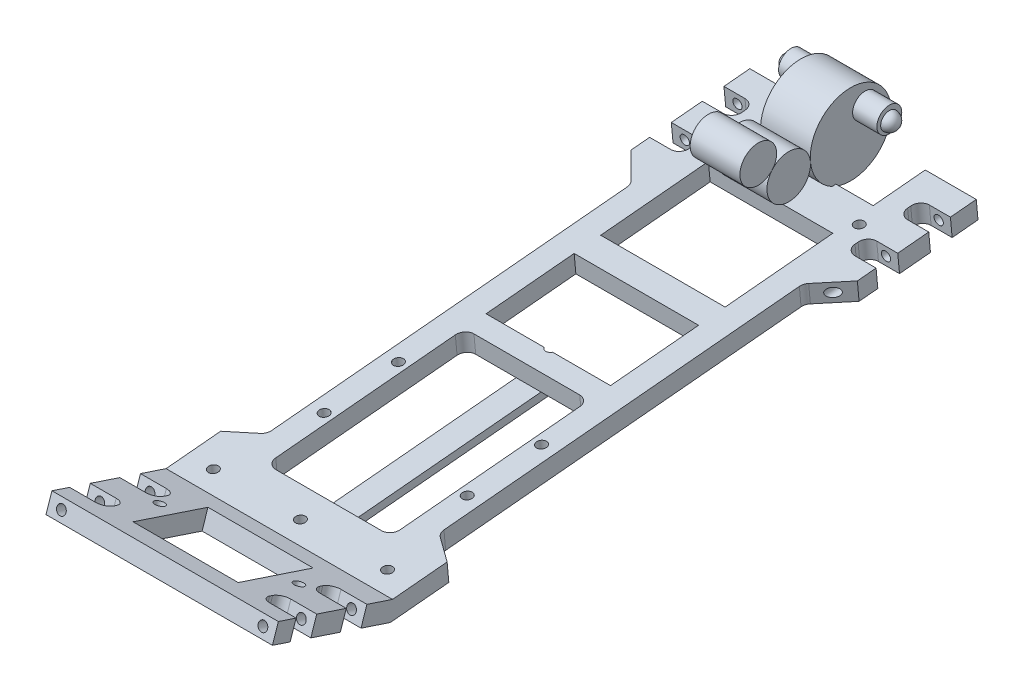
from build123d import *

# Parameters (mm, degrees)
FRAME_DEPTH              = 46.228
SKETCH7_R                = 2.032
SKETCH7_W                = 50.8
SKETCH7_H                = 73.673589013
SKETCH7_H_2              = 44.16344942
SKETCH7_H_3              = 36.113405855
BATTERY_SLOT_DEPTH       = 32.131
EXTRUDE25_DEPTH          = 12.7
LOW_A_ARM_MOUNTING_DEPTH = 18.288
SKETCH25_R               = 1.905
REAR_HINGE_HOLES_DEPTH   = 72.39
SKETCH26_R               = 16.51
EXTRUDE18_DEPTH          = 10.16
EXTRUDE18_2_DEPTH        = 10.16
SKETCH26_R_2             = 7.493
EXTRUDE18_3_DEPTH        = 10.16
SKETCH27_R               = 5.08
EXTRUDE19_DEPTH          = 20.066
SKETCH33_R               = 2.032
SKETCH33_R_2             = 1.905
EXTRUDE23_DEPTH          = 47.244
SKETCH32_R               = 2.032
SKETCH32_W               = 42.951687192
SKETCH32_H               = 32.245461994
EXTRUDE24_DEPTH          = 48.26
SKETCH34_R               = 1.905
EXTRUDE26_DEPTH          = 45.72
SKETCH38_R               = 2.032
EXTRUDE29_DEPTH          = 10
SKETCH35_R               = 2.032
EXTRUDE30_DEPTH          = 3.175


with BuildPart() as part:
    # Sketch2 → Frame (new, symmetric)
    with BuildSketch(Plane(origin=(0, 0, 0), x_dir=(0, 0, -1), z_dir=(1, 0, 0))):
        Polygon((-113.496221263, -18.267135855), (-65.375232853, -34.246135229), (199.160392748, -9.556529022), (198.452281288, -1.969502058), (-64.49133225, -26.510522792), (-111.094862411, -11.035408837), align=None)
    extrude(amount=FRAME_DEPTH, both=True)

    # Sketch7 → Battery Slot (cut)
    with BuildSketch(Plane(origin=(0, -20.314469691, -1.895987566), x_dir=(1, 0, 0), z_dir=(0, 0.9956728299897474, 0.0929280131080388))):
        with Locations((29.216865034, 11.53061946)):
            Circle(SKETCH7_R)
        with Locations((-29.216865034, 11.53061946)):
            Circle(SKETCH7_R)
        with Locations((-29.216865034, -18.94938054)):
            Circle(SKETCH7_R)
        with Locations((29.216865034, -18.94938054)):
            Circle(SKETCH7_R)
        with BuildLine():
            Line((-21.59, 34.834750886), (21.59, 34.834750886))
            ThreePointArc((21.59, 34.834750886), (24.284076836, 33.718827722), (25.4, 31.024750886))
            Line((25.4, 31.024750886), (25.4, -42.602437917))
            ThreePointArc((25.4, -42.602437917), (24.284076836, -45.296514753), (21.59, -46.412437917))
            Line((21.59, -46.412437917), (-21.59, -46.412437917))
            ThreePointArc((-21.59, -46.412437917), (-24.284076836, -45.296514753), (-25.4, -42.602437917))
            Line((-25.4, -42.602437917), (-25.4, 31.024750886))
            ThreePointArc((-25.4, 31.024750886), (-24.284076836, 33.718827722), (-21.59, 34.834750886))
        make_face()
        with Locations((0, 188.156895099)):
            Rectangle(SKETCH7_W, SKETCH7_H)
        with BuildLine():
            Line((55.96082371, -51.188879708), (36.758181354, -37.566371958))
            ThreePointArc((36.758181354, -37.566371958), (35.577748237, -36.207761713), (35.152650581, -34.458894617))
            Line((35.152650581, -34.458894617), (35.152650581, 111.272094787))
            ThreePointArc((35.152650581, 111.272094787), (35.442669563, 112.730118664), (36.268573745, 113.966171623))
            Line((36.268573745, 113.966171623), (55.96082371, 133.658421588))
            Line((55.96082371, 133.658421588), (55.96082371, -51.188879708))
        make_face()
        with BuildLine():
            Line((-55.96082371, 133.658421588), (-55.96082371, -51.188879708))
            Line((-55.96082371, -51.188879708), (-36.758181354, -37.566371958))
            ThreePointArc((-36.758181354, -37.566371958), (-35.577748237, -36.207761713), (-35.152650581, -34.458894617))
            Line((-35.152650581, -34.458894617), (-35.152650581, 111.272094787))
            ThreePointArc((-35.152650581, 111.272094787), (-35.442669563, 112.730118664), (-36.268573745, 113.966171623))
            Line((-36.268573745, 113.966171623), (-55.96082371, 133.658421588))
        make_face()
        with Locations((0, 112.716639569)):
            Rectangle(SKETCH7_W, SKETCH7_H_2)
        with Locations((0, 61.686944831)):
            Rectangle(SKETCH7_W, SKETCH7_H_3)
    extrude(amount=-BATTERY_SLOT_DEPTH, mode=Mode.SUBTRACT)

    # Sketch20 → Extrude25 (cut)
    with BuildSketch(Plane(origin=(0, -50.397568307, 16.734957844), x_dir=(1, 0, 0), z_dir=(0, -0.9490455404212153, 0.31513895698025596))):
        with BuildLine():
            Line((54.692263435, 94.336396504), (35.646708176, 94.336396504))
            ThreePointArc((35.646708176, 94.336396504), (32.952631339, 93.22047334), (31.836708176, 90.526396504))
            Line((31.836708176, 90.526396504), (31.836708176, 89.256396504))
            ThreePointArc((31.836708176, 89.256396504), (32.952631339, 86.562319667), (35.646708176, 85.446396504))
            Line((35.646708176, 85.446396504), (51.961047829, 85.446396504))
            Line((51.961047829, 85.446396504), (51.961047829, 72.746396504))
            Line((51.961047829, 72.746396504), (35.646708176, 72.746396504))
            ThreePointArc((35.646708176, 72.746396504), (32.952631339, 71.63047334), (31.836708176, 68.936396504))
            Line((31.836708176, 68.936396504), (31.836708176, 67.666396504))
            ThreePointArc((31.836708176, 67.666396504), (32.952631339, 64.972319667), (35.646708176, 63.856396504))
            Line((35.646708176, 63.856396504), (54.692263435, 63.856396504))
            Line((54.692263435, 63.856396504), (54.692263435, 94.336396504))
        make_face()
        with BuildLine():
            Line((-31.836708176, 68.936396504), (-31.836708176, 67.666396504))
            ThreePointArc((-31.836708176, 67.666396504), (-32.952631339, 64.972319667), (-35.646708176, 63.856396504))
            Line((-35.646708176, 63.856396504), (-54.692263435, 63.856396504))
            Line((-54.692263435, 63.856396504), (-54.692263435, 94.336396504))
            Line((-54.692263435, 94.336396504), (-35.646708176, 94.336396504))
            ThreePointArc((-35.646708176, 94.336396504), (-32.952631339, 93.22047334), (-31.836708176, 90.526396504))
            Line((-31.836708176, 90.526396504), (-31.836708176, 89.256396504))
            ThreePointArc((-31.836708176, 89.256396504), (-32.952631339, 86.562319667), (-35.646708176, 85.446396504))
            Line((-35.646708176, 85.446396504), (-51.961047829, 85.446396504))
            Line((-51.961047829, 85.446396504), (-51.961047829, 72.746396504))
            Line((-51.961047829, 72.746396504), (-35.646708176, 72.746396504))
            ThreePointArc((-35.646708176, 72.746396504), (-32.952631339, 71.63047334), (-31.836708176, 68.936396504))
        make_face()
    extrude(amount=-EXTRUDE25_DEPTH, mode=Mode.SUBTRACT)

    # Sketch24 → Low A-Arm Mounting (cut)
    with BuildSketch(Plane(origin=(0, -20.314469691, -1.895987566), x_dir=(1, 0, 0), z_dir=(0, 0.9956728299897474, 0.0929280131080388))):
        with BuildLine():
            Line((56.409110401, 131.608548499), (56.409110401, 162.088520321))
            Line((56.409110401, 162.088520321), (37.634475113, 162.088520321))
            ThreePointArc((37.634475113, 162.088520321), (34.940398277, 160.972597157), (33.824475113, 158.278520321))
            Line((33.824475113, 158.278520321), (33.824475113, 157.00853441))
            ThreePointArc((33.824475113, 157.00853441), (34.940398277, 154.314457574), (37.634475113, 153.19853441))
            Line((37.634475113, 153.19853441), (52.193835241, 153.19853441))
            Line((52.193835241, 153.19853441), (52.193835241, 140.49853441))
            Line((52.193835241, 140.49853441), (37.634475113, 140.49853441))
            ThreePointArc((37.634475113, 140.49853441), (34.940398277, 139.382611246), (33.824475113, 136.68853441))
            Line((33.824475113, 136.68853441), (33.824475113, 135.418548499))
            ThreePointArc((33.824475113, 135.418548499), (34.940398277, 132.724471663), (37.634475113, 131.608548499))
            Line((37.634475113, 131.608548499), (56.409110401, 131.608548499))
        make_face()
        with BuildLine():
            Line((-37.634475113, 131.608548499), (-56.409110401, 131.608548499))
            Line((-56.409110401, 131.608548499), (-56.409110401, 162.088520321))
            Line((-56.409110401, 162.088520321), (-37.634475113, 162.088520321))
            ThreePointArc((-37.634475113, 162.088520321), (-34.940398277, 160.972597157), (-33.824475113, 158.278520321))
            Line((-33.824475113, 158.278520321), (-33.824475113, 157.00853441))
            ThreePointArc((-33.824475113, 157.00853441), (-34.940398277, 154.314457574), (-37.634475113, 153.19853441))
            Line((-37.634475113, 153.19853441), (-52.193835241, 153.19853441))
            Line((-52.193835241, 153.19853441), (-52.193835241, 140.49853441))
            Line((-52.193835241, 140.49853441), (-37.634475113, 140.49853441))
            ThreePointArc((-37.634475113, 140.49853441), (-34.940398277, 139.382611246), (-33.824475113, 136.68853441))
            Line((-33.824475113, 136.68853441), (-33.824475113, 135.418548499))
            ThreePointArc((-33.824475113, 135.418548499), (-34.940398277, 132.724471663), (-37.634475113, 131.608548499))
        make_face()
        with BuildLine():
            Line((52.193835241, 172.685517507), (25.496906949, 172.685517507))
            ThreePointArc((25.496906949, 172.685517507), (22.802830113, 173.80144067), (21.686906949, 176.495517507))
            Line((21.686906949, 176.495517507), (21.686906949, 210.279969832))
            Line((21.686906949, 210.279969832), (63.30933631, 210.279969832))
            Line((63.30933631, 210.279969832), (52.193835241, 172.685517507))
        make_face()
        with BuildLine():
            Line((-63.30933631, 210.279969832), (-52.193835241, 172.685517507))
            Line((-52.193835241, 172.685517507), (-25.496906949, 172.685517507))
            ThreePointArc((-25.496906949, 172.685517507), (-22.802830113, 173.80144067), (-21.686906949, 176.495517507))
            Line((-21.686906949, 176.495517507), (-21.686906949, 210.279969832))
            Line((-21.686906949, 210.279969832), (-63.30933631, 210.279969832))
        make_face()
    extrude(amount=-LOW_A_ARM_MOUNTING_DEPTH, mode=Mode.SUBTRACT)

    # Sketch25 → Rear Hinge Holes (cut)
    with BuildSketch(Plane(origin=(0, 16.047322034, -171.938277914), x_dir=(-1, 0, 0), z_dir=(0, 0.09292801310803883, -0.9956728299897473))):
        with Locations((-41.073322363, -24.212755884)):
            Circle(SKETCH25_R)
        with Locations((41.073322363, -24.212755884)):
            Circle(SKETCH25_R)
    extrude(amount=-REAR_HINGE_HOLES_DEPTH, mode=Mode.SUBTRACT)

    # Sketch33 → Extrude23 (cut)
    with BuildSketch(Plane(origin=(0, -27.901496655, -2.604099026), x_dir=(1, 0, 0), z_dir=(0, -0.9956728299897473, -0.09292801310803918))):
        with Locations((28.407237147, -142.60872383)):
            Circle(SKETCH33_R)
        with Locations((-28.407237147, -142.60872383)):
            Circle(SKETCH33_R)
        with Locations((6.985, -101.71320122)):
            Circle(SKETCH33_R_2)
        with Locations((-6.985, -101.71320122)):
            Circle(SKETCH33_R_2)
        with Locations((-6.985, -192.443640667)):
            Circle(SKETCH33_R_2)
        with Locations((6.985, -192.443640667)):
            Circle(SKETCH33_R_2)
    extrude(amount=-EXTRUDE23_DEPTH, mode=Mode.SUBTRACT)

    # Sketch32 → Extrude24 (cut)
    with BuildSketch(Plane(origin=(0, -50.397568307, 16.734957844), x_dir=(1, 0, 0), z_dir=(0, -0.9490455404212153, 0.31513895698025585))):
        with Locations((28.407237147, 74.333896504)):
            Circle(SKETCH32_R)
        with Locations((-28.407237147, 74.333896504)):
            Circle(SKETCH32_R)
        with Locations((0, 77.015866104)):
            Rectangle(SKETCH32_W, SKETCH32_H)
    extrude(amount=-EXTRUDE24_DEPTH, mode=Mode.SUBTRACT)

    # Sketch34 → Extrude26 (cut)
    with BuildSketch(Plane(origin=(0, 32.130432452, 96.761263419), x_dir=(1, 0, 0), z_dir=(0, 0.3151389569802559, 0.9490455404212153))):
        with Locations((-41.141846717, -49.29342461)):
            Circle(SKETCH34_R)
        with Locations((41.141846717, -49.29342461)):
            Circle(SKETCH34_R)
    extrude(amount=-EXTRUDE26_DEPTH, mode=Mode.SUBTRACT)

    # Sketch38 → Extrude29 (cut)
    with BuildSketch(Plane(origin=(0, -20.314469691, -1.895987566), x_dir=(1, 0, 0), z_dir=(0, 0.9956728299897474, 0.0929280131080388))):
        with Locations((0, -57.996941554)):
            Circle(SKETCH38_R)
        with Locations((35.56, -57.996941554)):
            Circle(SKETCH38_R)
        with Locations((-35.56, -57.996941554)):
            Circle(SKETCH38_R)
        with Locations((0, 44.661295459)):
            Circle(SKETCH38_R)
    extrude(amount=-EXTRUDE29_DEPTH, mode=Mode.SUBTRACT)


with BuildPart() as body_2:
    # Sketch26 → Extrude18 (new, symmetric)
    with BuildSketch(Plane(origin=(0, 0, 0), x_dir=(0, 0, -1), z_dir=(1, 0, 0))):
        with Locations((158.63131502, 8.344645738)):
            Circle(SKETCH26_R)
    extrude(amount=EXTRUDE18_DEPTH, both=True)


with BuildPart() as body_3:
    # Sketch26 → Extrude18 2 (new, symmetric)
    with BuildSketch(Plane(origin=(0, 0, 0), x_dir=(0, 0, -1), z_dir=(1, 0, 0))):
        with BuildLine():
            ThreePointArc((142.192481652, 6.813352989), (136.038170827, 14.45971983), (126.595687803, 11.779797825))
            ThreePointArc((126.595687803, 11.779797825), (130.643433481, -2.482098519), (142.192481652, 6.813352989))
        make_face()
    extrude(amount=EXTRUDE18_2_DEPTH, both=True)


with BuildPart() as body_4:
    # Sketch26 → Extrude18 3 (new, symmetric)
    with BuildSketch(Plane(origin=(0, 0, 0), x_dir=(0, 0, -1), z_dir=(1, 0, 0))):
        with Locations((120.910520386, 16.660773183)):
            Circle(SKETCH26_R_2)
    extrude(amount=EXTRUDE18_3_DEPTH, both=True)


with BuildPart() as body_5:
    # Sketch27 → Extrude19 (new, symmetric)
    with BuildSketch(Plane(origin=(0, 0, 0), x_dir=(0, 0, -1), z_dir=(1, 0, 0))):
        with Locations((164.502748484, 15.591759218)):
            Circle(SKETCH27_R)
    extrude(amount=EXTRUDE19_DEPTH, both=True)

    # Sketch31 → Revolve4 (revolve)
    with BuildSketch(Plane.ZY.offset(20.066)):
        with BuildLine():
            Line((-164.541970413, 18.74430094), (-164.541970413, 11.598734462))
            ThreePointArc((-164.541970413, 11.598734462), (-160.969187174, 15.171517701), (-164.541970413, 18.74430094))
        make_face()
    revolve(axis=Axis((-20.066, 18.74430094, -164.541970413), (0, -1, 0)))


with BuildPart() as body_6:
    # Sketch30 → Revolve3 (revolve)
    with BuildSketch(Plane(origin=(20.066, 0, 0), x_dir=(0, 0, -1), z_dir=(1, 0, 0))):
        with BuildLine():
            Line((164.541970413, 11.598734462), (164.541970413, 18.74430094))
            ThreePointArc((164.541970413, 18.74430094), (160.969187174, 15.171517701), (164.541970413, 11.598734462))
        make_face()
    revolve(axis=Axis((20.066, 11.598734462, -164.541970413), (0, 1, 0)))


with BuildPart() as body_7:
    # Sketch35 → Extrude30 (new body)
    with BuildSketch(Plane(origin=(0, -27.901496655, -2.604099026), x_dir=(1, 0, 0), z_dir=(0, -0.9956728299897473, -0.09292801310803918))):
        with BuildLine():
            Line((5.08, 57.970513217), (5.08, -44.661295459))
            ThreePointArc((5.08, -44.661295459), (0, -49.741295459), (-5.08, -44.661295459))
            Line((-5.08, -44.661295459), (-5.078790691, 57.859674963))
            ThreePointArc((-5.078790691, 57.859674963), (-0.055422426, 63.050210881), (5.08, 57.970513217))
        make_face()
        with Locations((0, -44.661295459)):
            Circle(SKETCH35_R, mode=Mode.SUBTRACT)
        with Locations((0, 57.970513217)):
            Circle(SKETCH35_R, mode=Mode.SUBTRACT)
    extrude(amount=EXTRUDE30_DEPTH)


solid = Compound([part.part, body_2.part, body_3.part, body_4.part, body_5.part, body_6.part, body_7.part])
